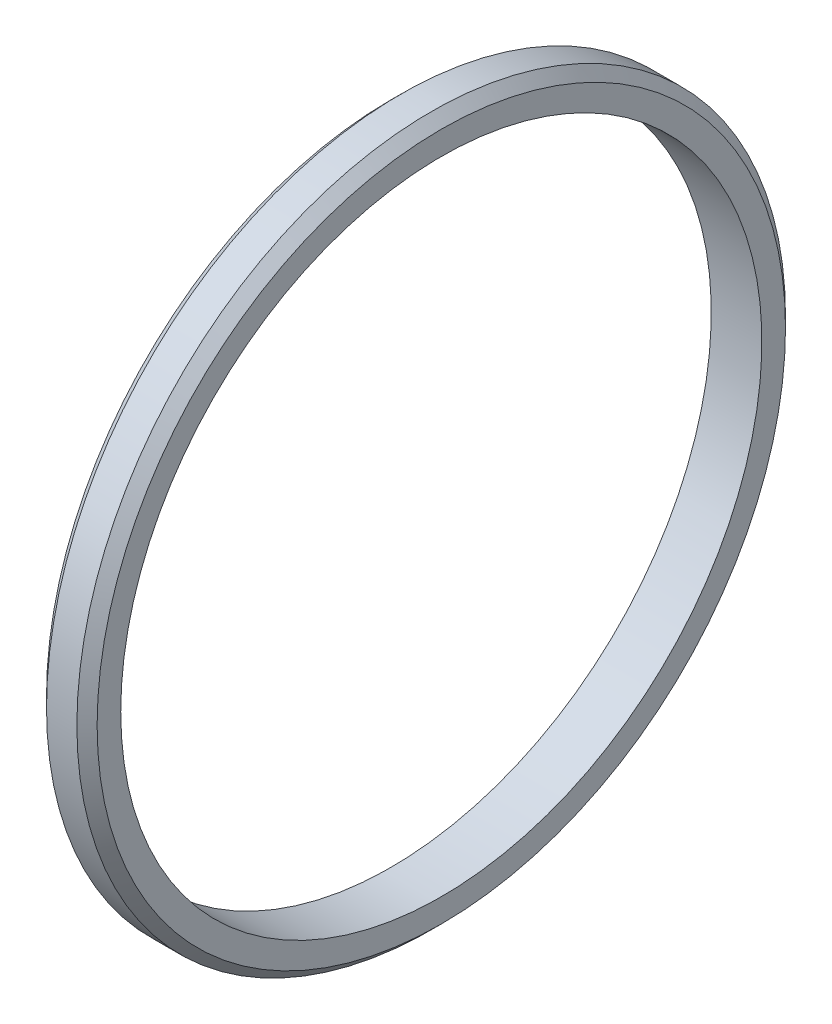
from build123d import *

# Parameters (mm, degrees)
SKETCH_1_W     = 3
SKETCH_1_H     = 2
CHAMFER_1_SIZE = 0.6


with BuildPart() as part:
    # Эскиз1 → Повернуть1 (revolve)
    with BuildSketch(Plane.XY, mode=Mode.PRIVATE) as revolve_1_sk:
        with Locations((1.5, 20)):
            Rectangle(SKETCH_1_W, SKETCH_1_H)
    revolve(revolve_1_sk.sketch.rotate(Axis((0, 0, 0), (1, 0, 0)), 90), axis=Axis((0, 0, 0), (1, 0, 0)))

    # Фаска1
    chamfer_1_edges = [part.edges().sort_by_distance(p)[0] for p in [
        (0, 0, -21),
        (3, 0, -21),
    ]]
    chamfer(chamfer_1_edges, length=CHAMFER_1_SIZE)


solid = part.part
